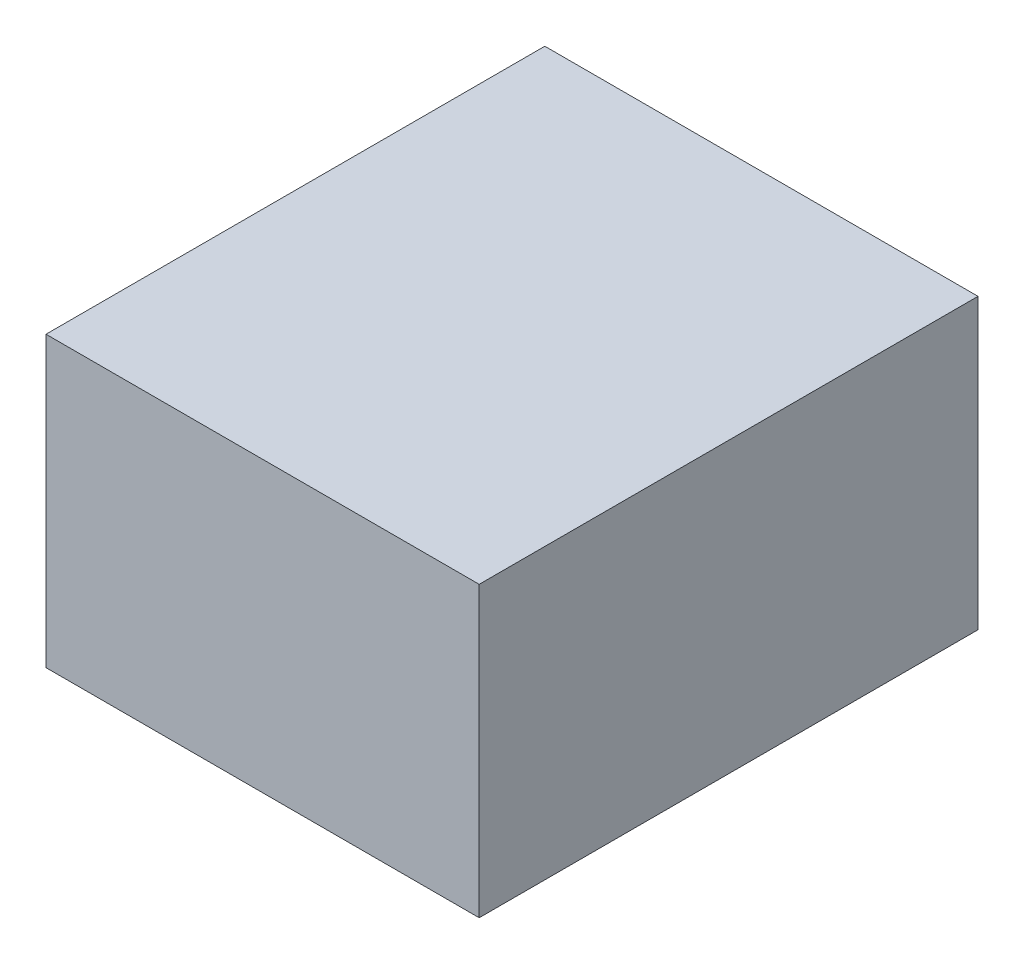
from build123d import *

# Parameters (mm, degrees)
SKETCH1_W           = 419.1
SKETCH1_H           = 482.6
BOSS_EXTRUDE1_DEPTH = 279.4


with BuildPart() as part:
    # Sketch1 → Boss-Extrude1 (new body)
    with BuildSketch(Plane(origin=(0, 0, 0), x_dir=(1, 0, 0), z_dir=(0, 1, 0))):
        Rectangle(SKETCH1_W, SKETCH1_H)
    extrude(amount=BOSS_EXTRUDE1_DEPTH)


solid = part.part
